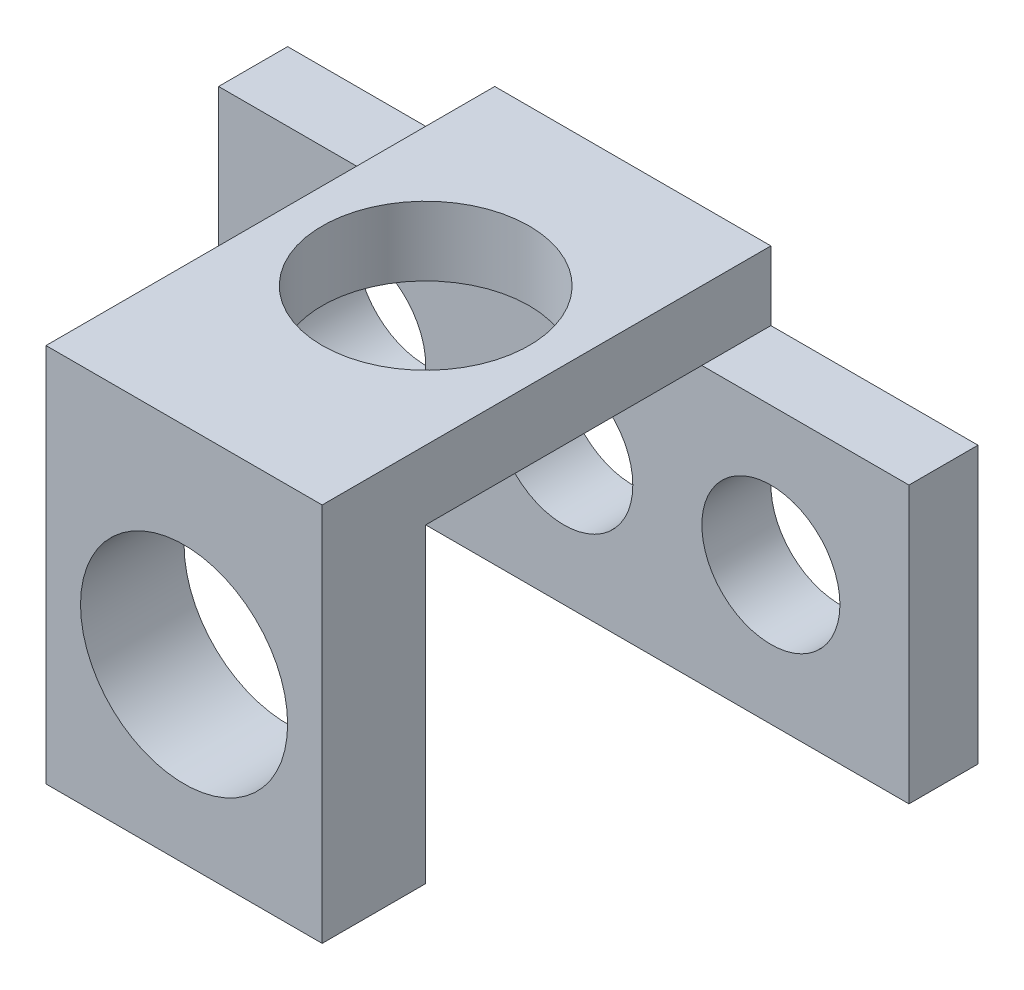
from build123d import *

# Parameters (mm, degrees)
ESBO_O1_W                = 100
ESBO_O1_H                = 10
RESSALTO_EXTRUS_O1_DEPTH = 40
ESBO_O3_W                = 40
ESBO_O3_H                = 10
RESSALTO_EXTRUS_O2_DEPTH = 65
ESBO_O4_W                = 40
ESBO_O4_H                = 15
RESSALTO_EXTRUS_O3_DEPTH = 45
ESBO_O5_R                = 10
CORTE_EXTRUS_O1_DEPTH    = 90.582364336
ESBO_O7_R                = 15
CORTE_EXTRUS_O3_DEPTH    = 45
ESBO_O6_R                = 15
CORTE_EXTRUS_O4_DEPTH    = 21


with BuildPart() as part:
    # Esboço1 → Ressalto-extrusão1 (new body)
    with BuildSketch(Plane(origin=(0, 0, 0), x_dir=(1, 0, 0), z_dir=(0, 1, 0))):
        with Locations((0, 5)):
            Rectangle(ESBO_O1_W, ESBO_O1_H)
    extrude(amount=RESSALTO_EXTRUS_O1_DEPTH)

    # Esboço3 → Ressalto-extrusão2 (add)
    with BuildSketch(Plane(origin=(0, 0, -10), x_dir=(-1, 0, 0), z_dir=(0, 0, -1))):
        with Locations((0, 45)):
            Rectangle(ESBO_O3_W, ESBO_O3_H)
    extrude(amount=-RESSALTO_EXTRUS_O2_DEPTH)

    # Esboço4 → Ressalto-extrusão3 (add)
    with BuildSketch(Plane.XZ.offset(-40)):
        with Locations((0, 47.5)):
            Rectangle(ESBO_O4_W, ESBO_O4_H)
    extrude(amount=RESSALTO_EXTRUS_O3_DEPTH)

    # Esboço5 → Corte-extrusão1 (cut, through all)
    with BuildSketch(Plane.XY):
        with Locations((-30, 20)):
            Circle(ESBO_O5_R)
        with Locations((30, 20)):
            Circle(ESBO_O5_R)
        with Locations((0, 20)):
            Circle(ESBO_O5_R)
    extrude(amount=-CORTE_EXTRUS_O1_DEPTH, mode=Mode.SUBTRACT)

    # Esboço7 → Corte-extrusão3 (cut)
    with BuildSketch(Plane(origin=(0, 50, 0), x_dir=(1, 0, 0), z_dir=(0, 1, 0))):
        with Locations(Location((0, -20, 0), (0, 0, 270))):
            Circle(ESBO_O7_R)
    extrude(amount=-CORTE_EXTRUS_O3_DEPTH, mode=Mode.SUBTRACT)

    # Esboço6 → Corte-extrusão4 (cut)
    with BuildSketch(Plane.XY.offset(55)):
        with Locations((0, 20)):
            Circle(ESBO_O6_R)
    extrude(amount=-CORTE_EXTRUS_O4_DEPTH, mode=Mode.SUBTRACT)


solid = part.part
